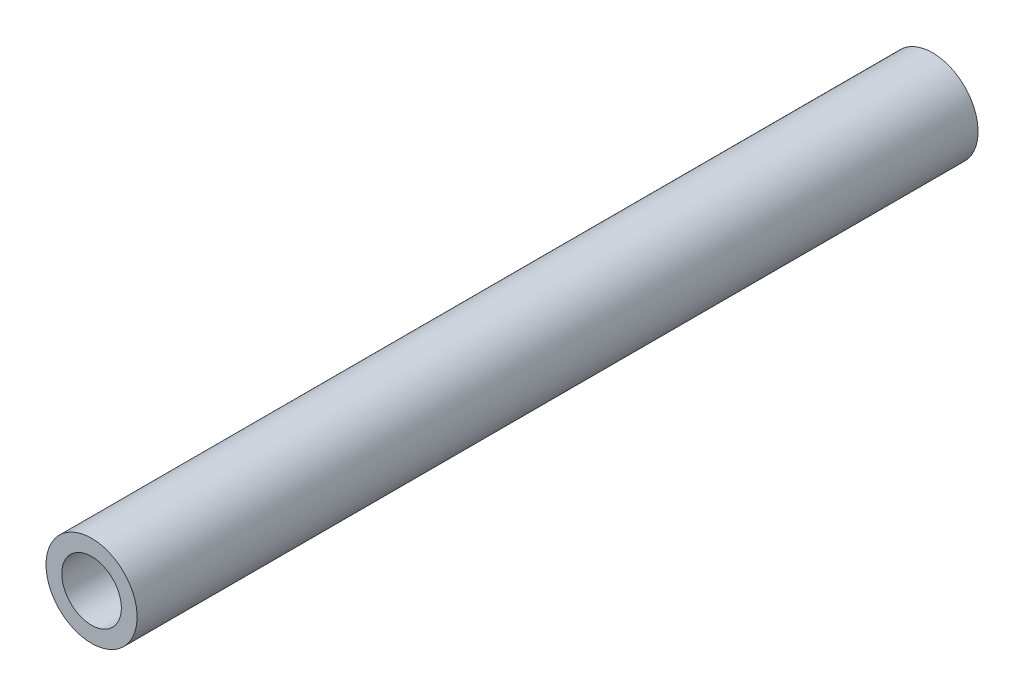
from build123d import *

# Parameters (mm, degrees)
SKETCH1_R           = 16.51
BOSS_EXTRUDE1_DEPTH = 304.8
SKETCH2_R           = 10.795
CUT_EXTRUDE1_DEPTH  = 306.692983564


with BuildPart() as part:
    # Sketch1 → Boss-Extrude1 (new body)
    with BuildSketch(Plane.XY):
        with Locations(Location((0, 0, 0), (0, 0, 180))):
            Circle(SKETCH1_R)
    extrude(amount=BOSS_EXTRUDE1_DEPTH)

    # Sketch2 → Cut-Extrude1 (cut, through all)
    with BuildSketch(Plane(origin=(0, 0, 0), x_dir=(-1, 0, 0), z_dir=(0, 0, -1))):
        Circle(SKETCH2_R)
    extrude(amount=-CUT_EXTRUDE1_DEPTH, mode=Mode.SUBTRACT)


solid = part.part
